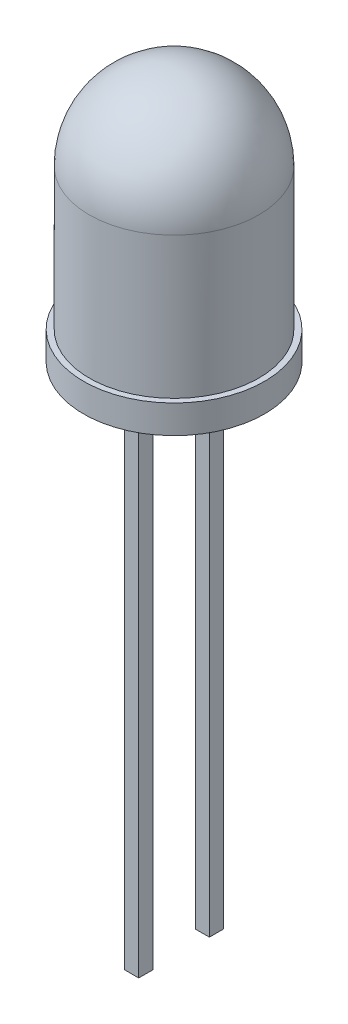
from build123d import *

# Parameters (mm, degrees)
SKETCH2_R           = 3.2
BOSS_EXTRUDE1_DEPTH = 1
SKETCH3_W           = 0.5
SKETCH3_H           = 0.5
BOSS_EXTRUDE2_DEPTH = 18


with BuildPart() as part:
    # Sketch1 → Revolve1 (revolve)
    with BuildSketch(Plane.XY, mode=Mode.PRIVATE) as revolve1_sk:
        with BuildLine():
            Line((0, 5), (0, 8))
            ThreePointArc((0, 8), (-2.121320344, 7.121320344), (-3, 5))
            Line((-3, 5), (-3, 0))
            Line((-3, 0), (0, 0))
            Line((0, 0), (0, 5))
        make_face()
    revolve(revolve1_sk.sketch.rotate(Axis((0, 0, 0), (0, 1, 0)), 270), axis=Axis((0, 0, 0), (0, 1, 0)))

    # Sketch2 → Boss-Extrude1 (add)
    with BuildSketch(Plane(origin=(0, 0, 0), x_dir=(-1, 0, 0), z_dir=(0, -1, 0))):
        with Locations(Location((0, 0, 0), (0, 0, 90))):
            Circle(SKETCH2_R)
    extrude(amount=BOSS_EXTRUDE1_DEPTH)

    # Sketch3 → Boss-Extrude2 (add)
    with BuildSketch(Plane(origin=(0, -1, 0), x_dir=(-1, 0, 0), z_dir=(0, -1, 0))):
        with Locations((0, -1.25)):
            Rectangle(SKETCH3_W, SKETCH3_H)
    boss_extrude2 = extrude(amount=BOSS_EXTRUDE2_DEPTH)

    # Mirror1: Boss-Extrude2 across plane
    add(boss_extrude2.mirror(Plane.XY))


solid = part.part
